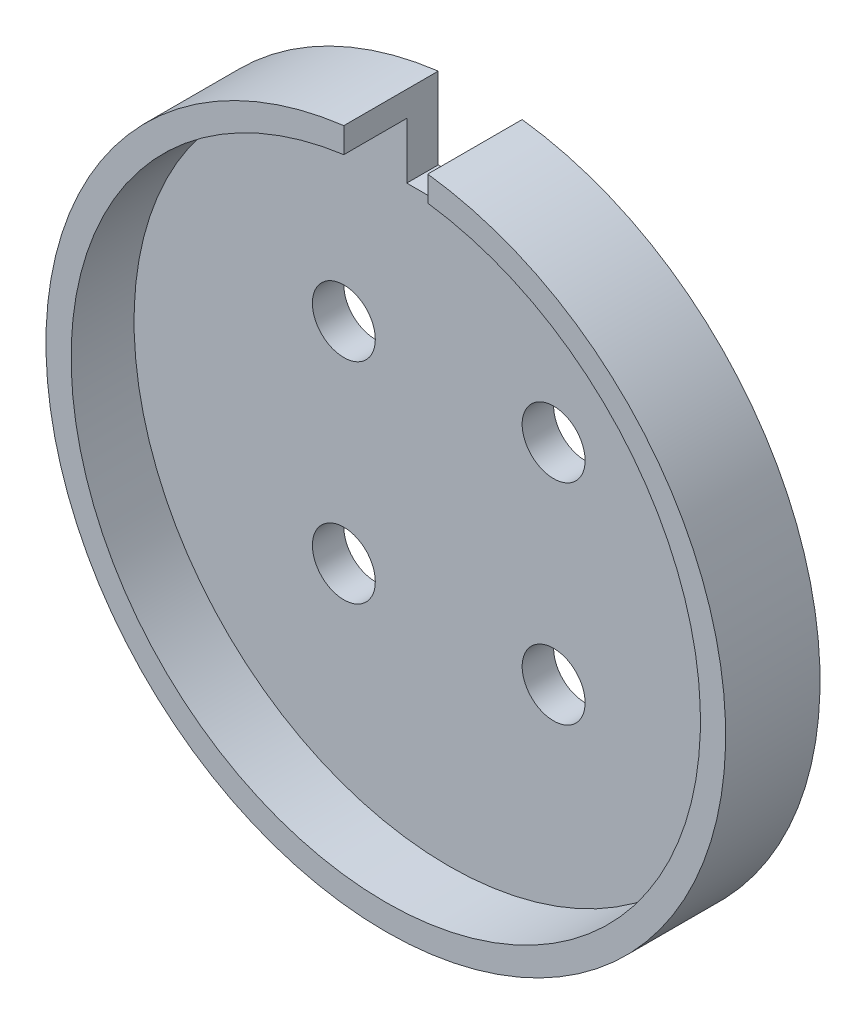
from build123d import *

# Parameters (mm, degrees)
CROQUIS1_R              = 1.5
SALIENTE_EXTRUIR1_DEPTH = 1.5
SALIENTE_EXTRUIR2_DEPTH = 3


with BuildPart() as part:
    # Croquis1 → Saliente-Extruir1 (new body)
    with BuildSketch(Plane.XY):
        with BuildLine():
            Line((-48.521455966, 14.990333384), (-48.521455966, 18.864023727))
            ThreePointArc((-48.521455966, 18.864023727), (-46.521455966, -13.412045444), (-44.521455966, 18.864023727))
            Line((-44.521455966, 18.864023727), (-44.521455966, 14.990333384))
            Line((-44.521455966, 14.990333384), (-48.521455966, 14.990333384))
        make_face()
        with Locations((-41.521455966, -2.212045444)):
            Circle(CROQUIS1_R, mode=Mode.SUBTRACT)
        with Locations((-51.521455966, -2.212045444)):
            Circle(CROQUIS1_R, mode=Mode.SUBTRACT)
        with Locations((-51.521455966, 7.787954556)):
            Circle(CROQUIS1_R, mode=Mode.SUBTRACT)
        with Locations((-41.521455966, 7.787954556)):
            Circle(CROQUIS1_R, mode=Mode.SUBTRACT)
    extrude(amount=SALIENTE_EXTRUIR1_DEPTH)

    # Croquis2 → Saliente-Extruir2 (add)
    with BuildSketch(Plane.XY.offset(1.5)):
        with BuildLine():
            Line((-48.521455966, 18.864023727), (-48.521455966, 17.664023727))
            ThreePointArc((-48.521455966, 17.664023727), (-46.523016697, -12.202149494), (-44.521455966, 17.663814696))
            Line((-44.521455966, 17.663814696), (-44.521455966, 18.864023727))
            ThreePointArc((-44.521455966, 18.864023727), (-46.521455966, -13.412045444), (-48.521455966, 18.864023727))
        make_face()
    extrude(amount=SALIENTE_EXTRUIR2_DEPTH)


solid = part.part
